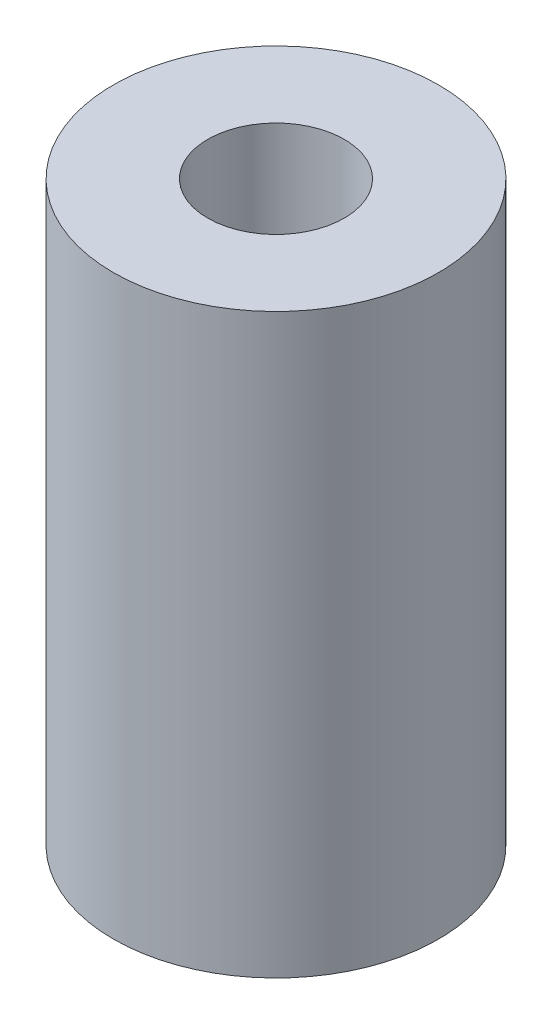
from build123d import *

# Parameters (mm, degrees)
SKETCH2_R           = 5
SKETCH2_R_2         = 2.1
BOSS_EXTRUDE1_DEPTH = 17.75


with BuildPart() as part:
    # Sketch2 → Boss-Extrude1 (new body)
    with BuildSketch(Plane(origin=(0, 0, 0), x_dir=(1, 0, 0), z_dir=(0, 1, 0))):
        with Locations(Location((0, 0, 0), (0, 0, 270))):
            Circle(SKETCH2_R)
        with Locations(Location((0, 0, 0), (0, 0, 270))):
            Circle(SKETCH2_R_2, mode=Mode.SUBTRACT)
    extrude(amount=BOSS_EXTRUDE1_DEPTH)


solid = part.part
